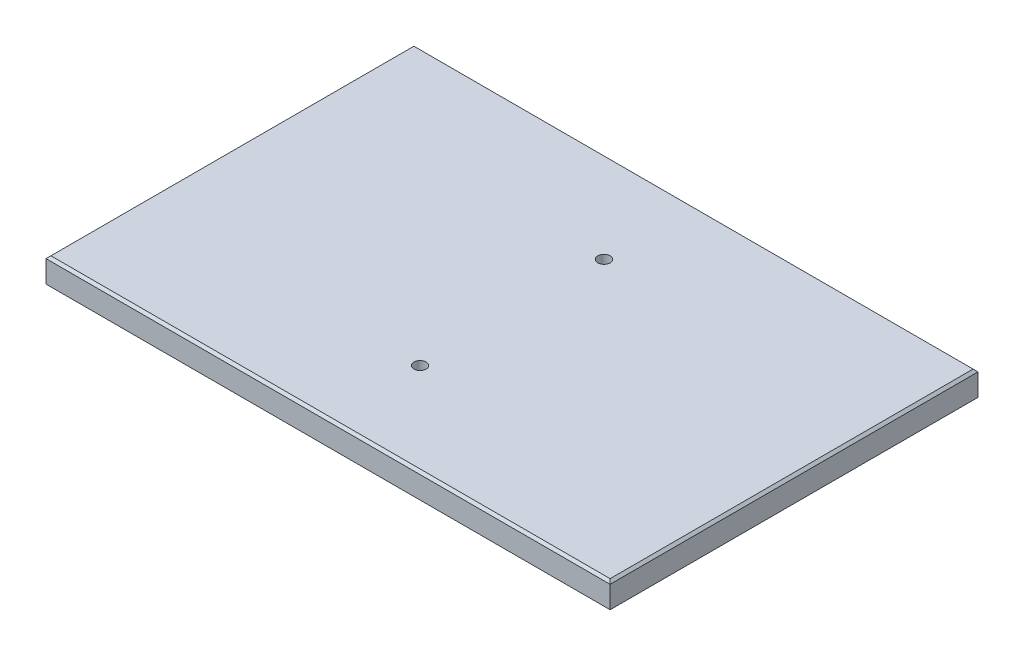
from build123d import *

# Parameters (mm, degrees)
SKETCH_1_W                = 230
SKETCH_1_H                = 150
EXTRUDE_1_DEPTH           = 10
CHAMFER_1_SIZE            = 1
F_5_0MM_DOWEL_HOLE1_D     = 5
F_5_0MM_DOWEL_HOLE1_DEPTH = 10
F_5_0MM_DOWEL_HOLE1_TIP   = 1.502151548


with BuildPart() as part:
    # Эскиз1 → Бобышка-Вытянуть1 (new body)
    with BuildSketch(Plane(origin=(0, 0, 0), x_dir=(1, 0, 0), z_dir=(0, 1, 0))):
        Rectangle(SKETCH_1_W, SKETCH_1_H)
    extrude(amount=-EXTRUDE_1_DEPTH)

    # Фаска1
    chamfer_1_edges = [part.edges().sort_by_distance(p)[0] for p in [
        (0, 0, 75),
        (-115, 0, 0),
        (0, 0, -75),
        (115, 0, 0),
    ]]
    chamfer(chamfer_1_edges, length=CHAMFER_1_SIZE)

    # Ø5.0mm Dowel Hole1
    with Locations(Plane(origin=(0, 0, 0), x_dir=(-1, 0, 0), z_dir=(0, 1, 0))):
        with Locations((0, 37.5), (0, -37.5)):
            Hole(F_5_0MM_DOWEL_HOLE1_D / 2, depth=F_5_0MM_DOWEL_HOLE1_DEPTH)
            with Locations((0, 0, -(F_5_0MM_DOWEL_HOLE1_DEPTH + F_5_0MM_DOWEL_HOLE1_TIP / 2))):  # 118° drill point
                Cone(0, F_5_0MM_DOWEL_HOLE1_D / 2, F_5_0MM_DOWEL_HOLE1_TIP, mode=Mode.SUBTRACT)


solid = part.part
